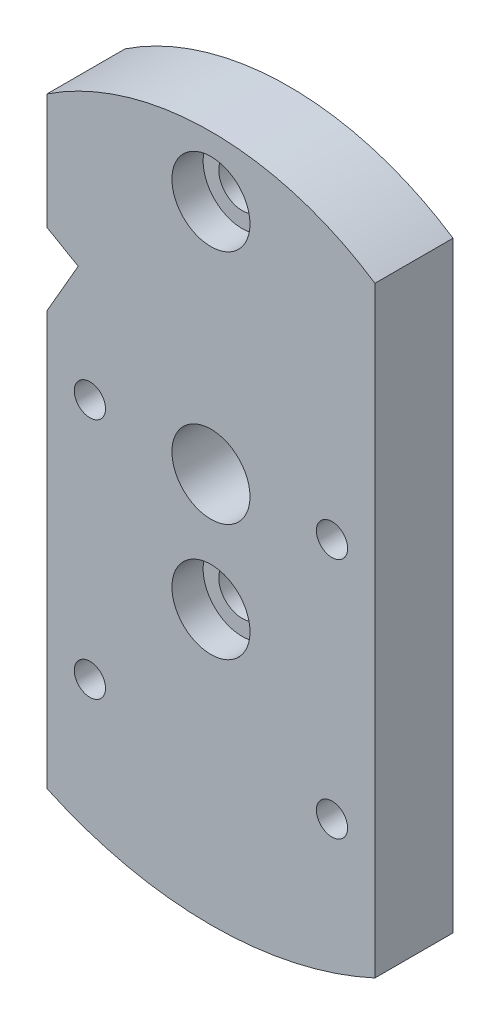
from build123d import *

# Parameters (mm, degrees)
SKIZZE1_R                       = 3
SKIZZE1_R_2                     = 5
SKIZZE1_R_3                     = 2
AUFSATZ_LINEAR_AUSTRAGEN1_DEPTH = 10
SKIZZE2_R                       = 5
SCHNITT_LINEAR_AUSTRAGEN1_DEPTH = 4
SKIZZE3_R                       = 3
SCHNITT_LINEAR_AUSTRAGEN2_DEPTH = 5
SCHNITT_LINEAR_AUSTRAGEN3_DEPTH = 10
SKIZZE6_R                       = 1.5
SCHNITT_LINEAR_AUSTRAGEN4_DEPTH = 20
M4_GEWINDEBOHRUNG3_D            = 3.3
M4_GEWINDEBOHRUNG3_DEPTH        = 20
M4_GEWINDEBOHRUNG3_CSINK_D      = 4.05
M4_GEWINDEBOHRUNG3_CSINK_ANGLE  = 90
M4_GEWINDEBOHRUNG3_TIP          = 0.991420021


with BuildPart() as part:
    # Skizze1 → Aufsatz-Linear austragen1 (new body)
    with BuildSketch(Plane.XY):
        with BuildLine():
            Line((-28.173757618, -45.853019157), (-28.173757618, -55.229224375))
            ThreePointArc((-28.173757618, -55.229224375), (-7.173757618, -59.853019157), (13.826242382, -55.229224375))
            Line((13.826242382, -55.229224375), (13.826242382, -45.853019157))
            Line((13.826242382, -45.853019157), (13.826242382, 21.817156087))
            ThreePointArc((13.826242382, 21.817156087), (-7.173757618, 28.146980843), (-28.173757618, 21.817156087))
            Line((-28.173757618, 21.817156087), (-28.173757618, -45.853019157))
        make_face()
        with Locations((-7.173757618, -24.853019157)):
            Circle(SKIZZE1_R, mode=Mode.SUBTRACT)
        with Locations((-7.173757618, -9.853019157)):
            Circle(SKIZZE1_R_2, mode=Mode.SUBTRACT)
        with Locations((-22.673757618, -9.353019157)):
            Circle(SKIZZE1_R_3, mode=Mode.SUBTRACT)
        with Locations((-22.673757618, -40.353019157)):
            Circle(SKIZZE1_R_3, mode=Mode.SUBTRACT)
        with Locations((8.326242382, -40.353019157)):
            Circle(SKIZZE1_R_3, mode=Mode.SUBTRACT)
        with Locations((8.326242382, -9.353019157)):
            Circle(SKIZZE1_R_3, mode=Mode.SUBTRACT)
        with Locations((-7.173757618, 20.376980843)):
            Circle(SKIZZE1_R, mode=Mode.SUBTRACT)
    extrude(amount=AUFSATZ_LINEAR_AUSTRAGEN1_DEPTH)

    # Skizze2 → Schnitt-Linear austragen1 (cut)
    with BuildSketch(Plane.XY.offset(10)):
        with Locations((-7.173757618, -24.853019157)):
            Circle(SKIZZE2_R)
        with Locations((-7.173757618, 20.376980843)):
            Circle(SKIZZE2_R)
    extrude(amount=-SCHNITT_LINEAR_AUSTRAGEN1_DEPTH, mode=Mode.SUBTRACT)

    # Skizze3 → Schnitt-Linear austragen2 (cut)
    with BuildSketch(Plane(origin=(0, 0, 0), x_dir=(-1, 0, 0), z_dir=(0, 0, -1))):
        with Locations((22.694764405, -40.331983862)):
            Circle(SKIZZE3_R)
        with Locations((-8.326242382, -40.353019157)):
            Circle(SKIZZE3_R)
        with Locations((22.673757618, -9.353019157)):
            Circle(SKIZZE3_R)
        with Locations((-8.347249168, -9.374054453)):
            Circle(SKIZZE3_R)
    extrude(amount=-SCHNITT_LINEAR_AUSTRAGEN2_DEPTH, mode=Mode.SUBTRACT)

    # Skizze5 → Schnitt-Linear austragen3 (cut)
    with BuildSketch(Plane.XY.offset(10)):
        Polygon((-28.173757618, -2.226086116), (-24.173757618, 4.702117114), (-28.173757618, 7.011518191), align=None)
    extrude(amount=-SCHNITT_LINEAR_AUSTRAGEN3_DEPTH, mode=Mode.SUBTRACT)

    # Skizze6 → Schnitt-Linear austragen4 (cut)
    with BuildSketch(Plane(origin=(-20.16639465, 11.64307338, 0), x_dir=(0, 0, 1), z_dir=(-0.8660254037844384, 0.5000000000000007, 0))):
        with Locations(Location((5, -12.014725937, 0), (0, 0, 270))):
            Circle(SKIZZE6_R)
    extrude(amount=-SCHNITT_LINEAR_AUSTRAGEN4_DEPTH, mode=Mode.SUBTRACT)

    # M4 Gewindebohrung3
    with Locations(Plane(origin=(-26.173757618, 1.238015499, 5), x_dir=(-0.5, -0.866025403784, 0), z_dir=(-0.866025403784, 0.5, 0))):
        with Locations((0, 0)):
            CounterSinkHole(M4_GEWINDEBOHRUNG3_D / 2, M4_GEWINDEBOHRUNG3_CSINK_D / 2, depth=M4_GEWINDEBOHRUNG3_DEPTH, counter_sink_angle=M4_GEWINDEBOHRUNG3_CSINK_ANGLE)
            with Locations((0, 0, -(M4_GEWINDEBOHRUNG3_DEPTH + M4_GEWINDEBOHRUNG3_TIP / 2))):  # 118° drill point
                Cone(0, M4_GEWINDEBOHRUNG3_D / 2, M4_GEWINDEBOHRUNG3_TIP, mode=Mode.SUBTRACT)


solid = part.part
